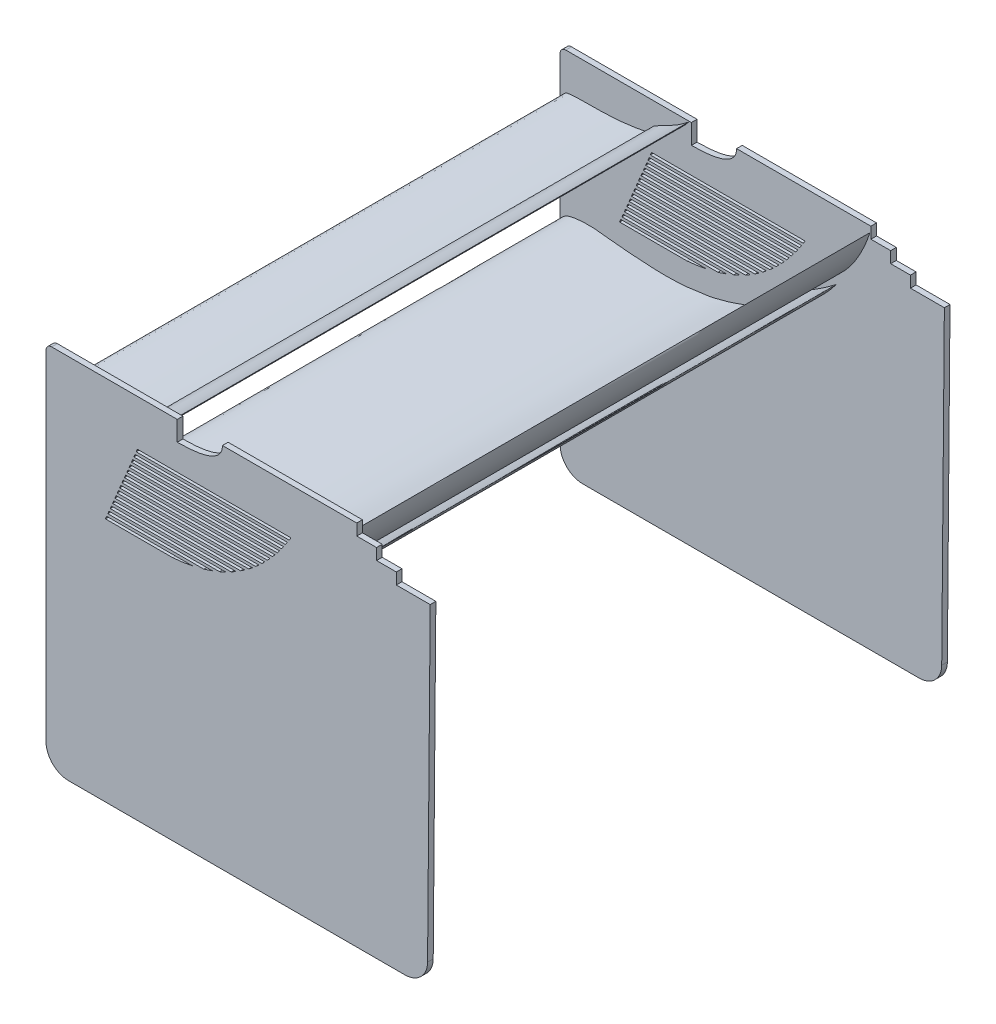
from build123d import *

# Parameters (mm, degrees)
BOSS_EXTRUDE1_DEPTH   = 900
BOSS_EXTRUDE1_2_DEPTH = 900
BOSS_EXTRUDE1_3_DEPTH = 900
BOSS_EXTRUDE2_DEPTH   = 10
BOSS_EXTRUDE3_DEPTH   = 900
CUT_EXTRUDE1_DEPTH    = 900
CUT_EXTRUDE2_DEPTH    = 900


with BuildPart() as part:
    # Sketch2 → Boss-Extrude1 (new body)
    with BuildSketch(Plane.XY):
        with BuildLine():
            add(Edge.make_bspline(
                [(0, 0), (-0.65975565, -5.699703464), (8.017548516, -15.480562025), (19.551157506, -21.724015646), (30.016745353, -25.302215165), (39.859962541, -28.8642232), (50.040399275, -30.662933418), (60.070603806, -32.257702331), (70.013877162, -34.217674322), (80.100972933, -34.55999195), (90.093066457, -35.36519438), (100.111969814, -35.952943269), (110.128217778, -35.507216678), (120.153157744, -35.210003546), (130.150331683, -34.229800116), (140.189993261, -33.410162922), (150.178235204, -31.913406007), (160.170449627, -30.371338734), (170.240789754, -29.163640841), (180.208316099, -27.151030087), (190.263801281, -25.306120223), (200.239152099, -22.872450662), (210.244577583, -20.429111012), (220.232934245, -17.895088966), (230.381125348, -15.705438437), (240.351948949, -12.391144832), (253.551193017, -7.369638816), (266.947574476, -2.806549313), (280.436865809, 1.636643436), (290.361357742, 5.819516769), (300.440735094, 10.032227759), (310.304777653, 14.884053202), (323.821431636, 20.884190166), (337.30228202, 27.249833417), (350.274680503, 34.850235797), (364.037447664, 41.200679435), (378.073354269, 50.431878374), (389.268655411, 56.991671546), (404.933124868, 70.670428585), (388.893146181, 60.897261379), (380.961681237, 56.833339948), (370.316551331, 52.173205743), (360.413556578, 47.749137904), (350.469658047, 43.075442492), (340.496714174, 38.833200032), (330.405194537, 35.260956145), (320.349773519, 31.849438488), (310.358327921, 28.32591748), (300.486931551, 24.662169398), (290.321799777, 22.300639283), (280.290360105, 19.76188557), (270.426731207, 16.765017679), (260.335958512, 15.061341224), (250.276874186, 13.958758108), (240.266180313, 12.578254982), (230.278688892, 11.06786106), (220.28670052, 9.696364143), (210.243264635, 9.240413966), (200.228739037, 9.034505305), (190.217040672, 8.279165066), (180.212460889, 9.162360851), (170.184221628, 8.728504773), (160.186505008, 9.582197967), (150.167787888, 9.989196896), (140.163470123, 10.700746944), (130.145958281, 11.214450998), (120.121382338, 11.840881885), (110.132801048, 12.969737489), (100.114836916, 13.850136605), (90.093770057, 14.715857774), (80.079633724, 15.842660607), (56.917746978, 18.847498868), (32.382831952, 18.963380484), (8.41761673, 12.262874152), (0.546057517, 4.717452477), (0, 0)],
                knots=[0, 0, 0, 0, 0.022023736, 0.035622153, 0.048196888, 0.060584536, 0.072602109, 0.084545422, 0.096478612, 0.108283816, 0.120089627, 0.131879307, 0.143660654, 0.15544949, 0.167268546, 0.17910001, 0.190991158, 0.20289685, 0.214787999, 0.226765538, 0.23876847, 0.250863752, 0.262991876, 0.27512, 0.287234564, 0.299600692, 0.31214973, 0.337081787, 0.34954249, 0.362249466, 0.375072168, 0.388091419, 0.401030286, 0.427260863, 0.440708926, 0.453891579, 0.481343844, 0.495528159, 0.510184265, 0.522427916, 0.535732546, 0.548643086, 0.561553626, 0.574510663, 0.587286643, 0.599816472, 0.612271303, 0.624763182, 0.637218013, 0.649381244, 0.661544475, 0.673750263, 0.685718325, 0.697586388, 0.709471547, 0.721375261, 0.733243324, 0.745039761, 0.756824219, 0.768610895, 0.780397571, 0.792175284, 0.803971722, 0.815766061, 0.82756692, 0.839363385, 0.851169099, 0.863005976, 0.874833225, 0.886659586, 0.898509641, 0.910371212, 0.969295412, 0.981771696, 1, 1, 1, 1], degree=3))
        make_face()
    extrude(amount=BOSS_EXTRUDE1_DEPTH)



with BuildPart() as body_2:
    # Sketch2 → Boss-Extrude1 2 (new body)
    with BuildSketch(Plane.XY):
        with BuildLine():
            add(Edge.make_bspline(
                [(488.73992863, 146.276625829), (488.734390863, 146.282664356), (488.424255517, 146.015046997), (488.06224571, 145.78510435), (487.262468982, 145.126312202), (486.219708703, 144.371292999), (484.873478649, 143.336701677), (483.250678892, 142.116067573), (481.344943871, 140.702556836), (479.183854282, 139.108333078), (476.761259361, 137.364331889), (474.123745832, 135.449437464), (471.236790602, 133.439330858), (468.165688429, 131.291310186), (464.896239769, 129.067635846), (461.457519682, 126.769533617), (457.874048726, 124.410588123), (454.151349507, 122.026984888), (450.329646269, 119.608278587), (446.41836705, 117.19210493), (442.442349173, 114.792641259), (438.43193703, 112.415341988), (434.42114363, 110.058907294), (430.419325782, 107.74839744), (426.469079038, 105.475179612), (422.572434597, 103.270040027), (418.782946314, 101.105445668), (415.103822048, 99.01892845), (411.581105321, 96.980001912), (408.223119368, 95.024650916), (405.070149132, 93.117181313), (402.117764879, 91.312769814), (399.415735867, 89.554324386), (396.965291652, 87.893504979), (394.792388291, 86.318571947), (392.915837215, 84.829964237), (391.349809227, 83.430905822), (390.083467317, 82.150893966), (389.152598068, 80.964624913), (388.566460536, 79.872034746), (388.31048608, 78.86894122), (388.452520239, 77.947544055), (389.013376817, 77.204475769), (389.915554573, 76.684991476), (391.128157446, 76.384212118), (392.650081725, 76.254634507), (394.48507873, 76.313765499), (396.623198675, 76.579439281), (399.045948072, 77.035742523), (401.735792151, 77.720460618), (404.675674285, 78.596752435), (407.839178956, 79.704940552), (411.200777121, 81.026852514), (414.720896472, 82.590974299), (418.395557374, 84.341793332), (422.179917585, 86.309143039), (426.045683707, 88.480043342), (429.970357242, 90.828820323), (433.914957703, 93.364526939), (437.871228384, 96.040204149), (441.793376071, 98.866131635), (445.668479549, 101.797178284), (449.465692449, 104.827226536), (453.167907327, 107.924049831), (456.76145535, 111.053999458), (460.202936902, 114.219487851), (463.519091154, 117.342970547), (466.650128692, 120.455005022), (469.613566921, 123.489837804), (472.370170636, 126.450937081), (474.953957291, 129.265647603), (477.297780382, 131.960513478), (479.456204478, 134.463515761), (481.381106749, 136.784579704), (483.077897662, 138.897364919), (484.557730654, 140.769579134), (485.809879979, 142.38248786), (486.847928071, 143.738913606), (487.625844434, 144.768628828), (488.251100258, 145.595659419), (488.480713959, 145.957078055), (488.74539046, 146.270670107), (488.73992863, 146.276625829)],
                knots=[0, 0, 0, 0, 0.000781199, 0.003073574, 0.006930933, 0.012248071, 0.019030102, 0.027225991, 0.036784991, 0.047610037, 0.059602429, 0.072763906, 0.086896902, 0.102003859, 0.117938515, 0.134556032, 0.151857595, 0.169650659, 0.187837924, 0.206373783, 0.225065344, 0.243814112, 0.262569213, 0.281136751, 0.299513586, 0.317505655, 0.335105223, 0.352118009, 0.368487898, 0.384166869, 0.39895523, 0.412906354, 0.425871787, 0.437810597, 0.448585292, 0.458212857, 0.466668993, 0.473884465, 0.479894259, 0.484778924, 0.488742849, 0.492166792, 0.495627983, 0.499576303, 0.504486665, 0.51057614, 0.517942731, 0.526573967, 0.536524046, 0.547640111, 0.560015283, 0.573490911, 0.58803144, 0.603543533, 0.619911609, 0.637089411, 0.654944026, 0.673346428, 0.692212491, 0.711460838, 0.730910148, 0.750475101, 0.77002178, 0.789460649, 0.808651173, 0.827457923, 0.845819698, 0.863558965, 0.880665567, 0.896944906, 0.912322084, 0.926717772, 0.939992516, 0.952161421, 0.963060032, 0.972661788, 0.980906352, 0.987732879, 0.993080076, 0.996902186, 0.999229514, 1, 1, 1, 1], degree=3))
        make_face()
    extrude(amount=BOSS_EXTRUDE1_2_DEPTH)


with BuildPart() as body_3:
    # Sketch2 → Boss-Extrude1 3 (new body)
    with BuildSketch(Plane.XY):
        with BuildLine():
            add(Edge.make_bspline(
                [(548.142677429, 255.362022493), (548.135374227, 255.365952606), (547.927936153, 255.006923964), (547.658371583, 254.666651265), (547.113002911, 253.770748213), (546.367364831, 252.702005657), (545.424638558, 251.265023805), (544.27941979, 249.558165284), (542.927897021, 247.572779047), (541.392389605, 245.329670238), (539.656724271, 242.856366084), (537.77246287, 240.148181213), (535.681420522, 237.265978202), (533.460225952, 234.1906606), (531.074588655, 230.97702341), (528.551895931, 227.635912658), (525.911068883, 224.188473742), (523.145346923, 220.671136821), (520.29665909, 217.087300279), (517.361495783, 213.476080086), (514.358883712, 209.859293663), (511.316016626, 206.252251869), (508.265842752, 202.665029322), (505.208968651, 199.124696426), (502.1889872, 195.637173296), (499.197596623, 192.232566763), (496.295154414, 188.902374923), (493.472239146, 185.683544867), (490.783011296, 182.562252326), (488.223454385, 179.575667492), (485.843956575, 176.703071592), (483.621924068, 173.995738505), (481.623931594, 171.41564926), (479.833965661, 169.012598811), (478.280745879, 166.784000715), (476.982109533, 164.736533764), (475.9505309, 162.877995089), (475.165835333, 161.232977644), (474.670653437, 159.789198906), (474.473857946, 158.549678558), (474.562913108, 157.505571006), (475.005273255, 156.671993733), (475.788683212, 156.148250847), (476.823995566, 155.951818146), (478.083297743, 156.067751239), (479.581340455, 156.450270824), (481.315884792, 157.117361276), (483.27148496, 158.082761094), (485.435756441, 159.325104089), (487.779363945, 160.874677932), (490.298259918, 162.690587977), (492.953775055, 164.80259248), (495.727550679, 167.184824621), (498.572278285, 169.851349424), (501.502624239, 172.747773867), (504.46579375, 175.887697633), (507.439057803, 179.249297912), (510.409450838, 182.800544998), (513.336696107, 186.537123271), (516.228525151, 190.411393589), (519.037740226, 194.417946242), (521.767005491, 198.509337516), (524.388867963, 202.669455575), (526.897696092, 206.861800297), (529.291618766, 211.049656155), (531.528344155, 215.220888935), (533.659235885, 219.310264722), (535.616969063, 223.327101968), (537.440168258, 227.214370322), (539.090171449, 230.962330487), (540.623673351, 234.512844247), (541.967651222, 237.868945421), (543.198230675, 240.979940777), (544.266104832, 243.839306635), (545.18521028, 246.423662369), (545.97695415, 248.705848341), (546.637316417, 250.664385968), (547.178342468, 252.306492823), (547.579395063, 253.549717004), (547.901947032, 254.548383811), (548.001197383, 254.970292394), (548.149880485, 255.358146272), (548.142677429, 255.362022493)],
                knots=[0, 0, 0, 0, 0.000781199, 0.003073574, 0.006930933, 0.012248071, 0.019030102, 0.027225991, 0.036784991, 0.047610037, 0.059602429, 0.072763906, 0.086896902, 0.102003859, 0.117938515, 0.134556032, 0.151857595, 0.169650659, 0.187837924, 0.206373783, 0.225065344, 0.243814112, 0.262569213, 0.281136751, 0.299513586, 0.317505655, 0.335105223, 0.352118009, 0.368487898, 0.384166869, 0.39895523, 0.412906354, 0.425871787, 0.437810597, 0.448585292, 0.458212857, 0.466668993, 0.473884465, 0.479894259, 0.484778924, 0.488742849, 0.492166792, 0.495627983, 0.499576303, 0.504486665, 0.51057614, 0.517942731, 0.526573967, 0.536524046, 0.547640111, 0.560015283, 0.573490911, 0.58803144, 0.603543533, 0.619911609, 0.637089411, 0.654944026, 0.673346428, 0.692212491, 0.711460838, 0.730910148, 0.750475101, 0.77002178, 0.789460649, 0.808651173, 0.827457923, 0.845819698, 0.863558965, 0.880665567, 0.896944906, 0.912322084, 0.926717772, 0.939992516, 0.952161421, 0.963060032, 0.972661788, 0.980906352, 0.987732879, 0.993080076, 0.996902186, 0.999229514, 1, 1, 1, 1], degree=3))
        make_face()
    extrude(amount=BOSS_EXTRUDE1_3_DEPTH)


with BuildPart() as part_1:
    add(part.part)

    add(body_2.part)  # Boss-Extrude2 merges body 2

    add(body_3.part)  # Boss-Extrude2 merges body 3
    # Sketch5 → Boss-Extrude2 (add)
    with BuildSketch(Plane.XY):
        with BuildLine():
            Line((10, 266.2835253), (550.000000941, 266.2835253))
            Line((550.000000941, 266.2835253), (550.000000941, 246.2835253))
            Line((550.000000941, 246.2835253), (585.000000941, 246.2835253))
            Line((585.000000941, 246.2835253), (585.000000941, 226.2835253))
            Line((585.000000941, 226.2835253), (620.000000941, 226.2835253))
            Line((620.000000941, 226.2835253), (620.000000941, 206.2835253))
            Line((620.000000941, 206.2835253), (680.000000941, 206.2835253))
            Line((680.000000941, 206.2835253), (675.336111358, -344.055445579))
            ThreePointArc((675.336111358, -344.055445579), (663.501719613, -372.120337423), (635.337547649, -383.7164747))
            Line((635.337547649, -383.7164747), (40, -383.7164747))
            ThreePointArc((40, -383.7164747), (11.715728753, -372.000745948), (0, -343.7164747))
            Line((0, -343.7164747), (0, 0))
            Line((0, 0), (0, 256.2835253))
            ThreePointArc((0, 256.2835253), (2.928932188, 263.354593111), (10, 266.2835253))
        make_face()
    boss_extrude2 = extrude(amount=-BOSS_EXTRUDE2_DEPTH)

    # Sketch6 → Boss-Extrude3 (add)
    with BuildSketch(Plane.XY):
        with BuildLine():
            Line((164.613779142, 214.976136412), (164.723820378, 214.664469851))
            add(Edge.make_bspline(
                [(164.723820378, 214.664469851), (164.648520792, 214.62785328), (164.34784185, 214.481639572), (163.6724355, 214.155247545), (162.549996952, 213.617503095), (160.985188719, 212.878254816), (158.984976969, 211.950245078), (156.558091459, 210.85008651), (153.715646415, 209.596574891), (150.470623362, 208.21147628), (146.838789716, 206.717746076), (142.837921693, 205.140231242), (138.488175426, 203.504962048), (133.812181859, 201.837638924), (128.834692226, 200.164989269), (123.582914289, 198.512714614), (118.086213642, 196.905948015), (112.376209789, 195.368272822), (106.486191905, 193.922834665), (100.451747873, 192.589384758), (94.309682922, 191.38731623), (88.098789404, 190.332048871), (81.858862431, 189.437445075), (75.630944666, 188.713169975), (69.456595048, 188.167141909), (63.377832973, 187.802732102), (57.436667454, 187.619920942), (51.674457693, 187.615799885), (46.131746943, 187.783455241), (40.847534236, 188.112237796), (35.858963346, 188.588868306), (31.20097477, 189.198026011), (26.905404603, 189.920290668), (23.001348407, 190.736844339), (19.514136341, 191.626300897), (16.465607968, 192.567963312), (13.873059459, 193.541178882), (11.74976335, 194.527328758), (10.100256038, 195.510564925), (8.925718365, 196.483778626), (8.206176783, 197.466132507), (8.02697547, 198.508882414), (8.470227148, 199.467441428), (9.409476098, 200.23160778), (10.773566742, 200.880043737), (12.581737712, 201.435839127), (14.827891197, 201.90662304), (17.501946446, 202.294971106), (20.58639208, 202.606885827), (24.061416159, 202.847331482), (27.90441349, 203.025263473), (32.091168331, 203.149306121), (36.595944484, 203.230963582), (41.391766004, 203.282006476), (46.450521964, 203.315413628), (51.743070657, 203.344475349), (57.239340133, 203.383502231), (62.908274903, 203.445583094), (68.717937055, 203.543500979), (74.635487392, 203.689136944), (80.627254443, 203.892101324), (86.658821204, 204.160206649), (92.695207803, 204.498909479), (98.701000079, 204.910411263), (104.640477999, 205.395096222), (110.477863333, 205.94945889), (116.177758049, 206.567602145), (121.705063984, 207.24121294), (127.025524467, 207.95920193), (132.10555678, 208.709379121), (136.913134386, 209.476904936), (141.417305129, 210.247217657), (145.589030953, 211.004246644), (149.400935644, 211.732409722), (152.827876226, 212.416494827), (155.846829262, 213.041879937), (158.437432591, 213.595225115), (160.581893041, 214.064998422), (162.265605107, 214.441007828), (163.476700085, 214.71550428), (164.206793843, 214.882591132), (164.532232533, 214.957392982), (164.613779142, 214.976136412)],
                knots=[0, 0, 0, 0, 0.000779512, 0.003112672, 0.006983595, 0.012366453, 0.01922443, 0.027511488, 0.037172952, 0.048145315, 0.060357993, 0.073731396, 0.088181725, 0.103618331, 0.119946063, 0.137064586, 0.154870456, 0.17325674, 0.192112831, 0.211327336, 0.230785914, 0.250372996, 0.269971687, 0.289465461, 0.308737124, 0.32767029, 0.346151173, 0.364066139, 0.381306847, 0.39776766, 0.413347451, 0.427951846, 0.441492525, 0.453889871, 0.465073667, 0.474985038, 0.483580064, 0.490834634, 0.496756017, 0.501407245, 0.504968517, 0.50787306, 0.510776977, 0.514326794, 0.518938798, 0.524777979, 0.531895445, 0.540287366, 0.549922226, 0.560751286, 0.572712462, 0.585735823, 0.599744882, 0.61465722, 0.63038614, 0.646841751, 0.663930407, 0.681556403, 0.699621216, 0.718024312, 0.736663476, 0.755434295, 0.774231121, 0.792947914, 0.811476445, 0.829708517, 0.847535554, 0.86485073, 0.881545736, 0.89751548, 0.912656405, 0.926869016, 0.94005631, 0.952127904, 0.962998201, 0.972589475, 0.980830171, 0.987660039, 0.993027268, 0.996891237, 0.999221024, 1, 1, 1, 1], degree=3))
        make_face()
        with BuildLine():
            Line((227.014165374, 264.226922408), (227.124498683, 264.117683735))
            add(Edge.make_bspline(
                [(227.124498683, 264.117683735), (227.100159849, 264.086786218), (227.002972401, 263.963409277), (226.784244674, 263.687135237), (226.419789721, 263.229980722), (225.90956242, 262.59706416), (225.25389914, 261.795199069), (224.453089487, 260.833196326), (223.507984217, 259.721278001), (222.419615428, 258.471304258), (221.18994955, 257.09620847), (219.821415035, 255.610135011), (218.317204263, 254.028215794), (216.681623457, 252.365949967), (214.919665011, 250.639704962), (213.037569937, 248.865917434), (211.042607934, 247.061225478), (208.943318901, 245.242073454), (206.749038269, 243.425062503), (204.470768289, 241.625829285), (202.120099201, 239.8601083), (199.710274859, 238.142361018), (197.255281925, 236.486595763), (194.770493839, 234.905301737), (192.271859948, 233.410335323), (189.776455231, 232.011724723), (187.302044509, 230.718062416), (184.866709335, 229.536586443), (182.489006296, 228.472674472), (180.187603898, 227.52980869), (177.980924736, 226.709979502), (175.886877861, 226.013863102), (173.922899143, 225.439766898), (172.105142481, 224.985691856), (170.448695615, 224.647782235), (168.967029431, 224.421758982), (167.671684859, 224.302431588), (166.572085289, 224.284645643), (165.673393307, 224.362629601), (164.977563579, 224.533619745), (164.472228287, 224.801628451), (164.182975782, 225.205799004), (164.174124327, 225.701813604), (164.414772581, 226.217190457), (164.858731971, 226.770618702), (165.509408986, 227.375799229), (166.362663608, 228.034709064), (167.413706516, 228.746373252), (168.653905221, 229.509744345), (170.073867156, 230.322864947), (171.662201674, 231.184893168), (173.406905, 232.094517404), (175.294740921, 233.051332311), (177.311894526, 234.054791381), (179.443823684, 235.104626545), (181.675486694, 236.200490389), (183.991239673, 237.342276403), (186.375273051, 238.529160164), (188.811466791, 239.760007307), (191.28350447, 241.033117593), (193.775182692, 242.345660362), (196.270350938, 243.693892226), (198.753103068, 245.072958488), (201.208015771, 246.476539327), (203.619908469, 247.897483995), (205.974372342, 249.326985329), (208.257648968, 250.755302848), (210.456601334, 252.171736048), (212.559016607, 253.564582929), (214.553192236, 254.921814136), (216.428626064, 256.230598714), (218.17521328, 257.47844315), (219.783967257, 258.652607865), (221.246503967, 259.740900035), (222.555307784, 260.731740538), (223.703638392, 261.614233662), (224.685618133, 262.378570601), (225.496085319, 263.016232908), (226.130951632, 263.519921264), (226.586785668, 263.883929527), (226.861249996, 264.104048143), (226.983526109, 264.202302404), (227.014165374, 264.226922408)],
                knots=[0, 0, 0, 0, 0.000779512, 0.003112672, 0.006983595, 0.012366453, 0.01922443, 0.027511488, 0.037172952, 0.048145315, 0.060357993, 0.073731396, 0.088181725, 0.103618331, 0.119946063, 0.137064586, 0.154870456, 0.17325674, 0.192112831, 0.211327336, 0.230785914, 0.250372996, 0.269971687, 0.289465461, 0.308737124, 0.32767029, 0.346151173, 0.364066139, 0.381306847, 0.39776766, 0.413347451, 0.427951846, 0.441492525, 0.453889871, 0.465073667, 0.474985038, 0.483580064, 0.490834634, 0.496756017, 0.501407245, 0.504968517, 0.50787306, 0.510776977, 0.514326794, 0.518938798, 0.524777979, 0.531895445, 0.540287366, 0.549922226, 0.560751286, 0.572712462, 0.585735823, 0.599744882, 0.61465722, 0.63038614, 0.646841751, 0.663930407, 0.681556403, 0.699621216, 0.718024312, 0.736663476, 0.755434295, 0.774231121, 0.792947914, 0.811476445, 0.829708517, 0.847535554, 0.86485073, 0.881545736, 0.89751548, 0.912656405, 0.926869016, 0.94005631, 0.952127904, 0.962998201, 0.972589475, 0.980830171, 0.987660039, 0.993027268, 0.996891237, 0.999221024, 1, 1, 1, 1], degree=3))
        make_face()
    extrude(amount=BOSS_EXTRUDE3_DEPTH)

    # Sketch7 → Cut-Extrude1 (cut)
    with BuildSketch(Plane.XY):
        with BuildLine():
            Line((232.261297878, 266.2835253), (232.261297878, 231.2835253))
            add(Edge.make_bspline(
                [(312.261297878, 266.2835253), (312.261297878, 231.2835253), (232.261297878, 231.2835253)],
                knots=[0, 0, 0, 1, 1, 1], degree=2))
            Line((312.261297878, 266.2835253), (232.261297878, 266.2835253))
        make_face()
    cut_extrude1 = extrude(amount=-CUT_EXTRUDE1_DEPTH, mode=Mode.SUBTRACT)

    # Sketch8 → Cut-Extrude2 (cut)
    with BuildSketch(Plane.XY):
        with BuildLine():
            Line((161.803662931, 185.278358624), (433.527522538, 185.278358624))
            add(Edge.make_bspline(
                [(433.527522538, 185.278358624), (431.986033483, 182.754958382), (430.420792306, 180.278358625)],
                knots=[0, 0, 0, 0.017044084, 0.017044084, 0.017044084], degree=2))
            Line((430.420792306, 180.278358625), (159.708601591, 180.278358625))
            Line((159.708601591, 180.278358625), (161.803662931, 185.278358624))
        make_face()
        with BuildLine():
            Line((155.51847891, 170.278358624), (423.874587116, 170.278358624))
            add(Edge.make_bspline(
                [(427.205326309, 175.278358623), (426.103638199, 173.59482896), (424.993391797, 171.928162297), (423.874587116, 170.278358624)],
                knots=[0.034416516, 0.034416516, 0.034416516, 0.034416516, 0.052137037, 0.052137037, 0.052137037, 0.052137037], degree=3))
            Line((427.205326309, 175.278358623), (157.61354025, 175.278358623))
            Line((157.61354025, 175.278358623), (155.51847891, 170.278358624))
        make_face()
        with BuildLine():
            Line((151.328356229, 160.278358623), (416.837622605, 160.278358623))
            add(Edge.make_bspline(
                [(420.421354783, 165.278358623), (419.236089505, 163.593343639), (418.041512112, 161.926676973), (416.837622605, 160.278358623)],
                knots=[0.070227449, 0.070227449, 0.070227449, 0.070227449, 0.088711929, 0.088711929, 0.088711929, 0.088711929], degree=3))
            Line((420.421354783, 165.278358623), (153.42341757, 165.278358623))
            Line((153.42341757, 165.278358623), (151.328356229, 160.278358623))
        make_face()
        with BuildLine():
            Line((147.138233549, 150.278358623), (409.241918291, 150.278358623))
            add(Edge.make_bspline(
                [(413.114471658, 155.278358622), (411.833832124, 153.591571342), (410.542981002, 151.924904676), (409.241918291, 150.278358623)],
                knots=[0.107617411, 0.107617411, 0.107617411, 0.107617411, 0.12697404, 0.12697404, 0.12697404, 0.12697404], degree=3))
            Line((413.114471658, 155.278358622), (149.233294889, 155.278358622))
            Line((149.233294889, 155.278358622), (147.138233549, 150.278358623))
        make_face()
        with BuildLine():
            Line((142.948110868, 140.278358622), (401.00217999, 140.278358622))
            add(Edge.make_bspline(
                [(405.208727185, 145.278358621), (403.817848225, 143.589419991), (402.415665827, 141.922753326), (401.00217999, 140.278358622)],
                knots=[0.146815745, 0.146815745, 0.146815745, 0.146815745, 0.167180931, 0.167180931, 0.167180931, 0.167180931], degree=3))
            Line((405.208727185, 145.278358621), (145.043172208, 145.278358621))
            Line((145.043172208, 145.278358621), (142.948110868, 140.278358622))
        make_face()
        with BuildLine():
            Line((138.757988187, 130.278358621), (392.008915127, 130.278358621))
            add(Edge.make_bspline(
                [(396.607785875, 135.278358621), (395.087485747, 133.586753391), (393.554528832, 131.920086723), (392.008915127, 130.278358621)],
                knots=[0.188113355, 0.188113355, 0.188113355, 0.188113355, 0.209663235, 0.209663235, 0.209663235, 0.209663235], degree=3))
            Line((396.607785875, 135.278358621), (140.853049527, 135.278358621))
            Line((140.853049527, 135.278358621), (138.757988187, 130.278358621))
        make_face()
        with BuildLine():
            Line((134.567865506, 120.278358621), (382.117568981, 120.278358621))
            add(Edge.make_bspline(
                [(387.186329186, 125.27835862), (385.511120845, 123.583361188), (383.821534109, 121.916694525), (382.117568981, 120.278358621)],
                knots=[0.231888664, 0.231888664, 0.231888664, 0.231888664, 0.254857463, 0.254857463, 0.254857463, 0.254857463], degree=3))
            Line((387.186329186, 125.27835862), (136.662926846, 125.27835862))
            Line((136.662926846, 125.27835862), (134.567865506, 120.278358621))
        make_face()
        with BuildLine():
            Line((130.377742825, 110.27835862), (371.130448262, 110.27835862))
            add(Edge.make_bspline(
                [(376.776145493, 115.278358619), (374.910888715, 113.578900458), (373.028989635, 111.912233792), (371.130448262, 110.27835862)],
                knots=[0.278649618, 0.278649618, 0.278649618, 0.278649618, 0.303360585, 0.303360585, 0.303360585, 0.303360585], degree=3))
            Line((376.776145493, 115.278358619), (132.472804165, 115.278358619))
            Line((132.472804165, 115.278358619), (130.377742825, 110.27835862))
        make_face()
        with BuildLine():
            Line((126.187620144, 100.278358619), (358.764540814, 100.278358619))
            add(Edge.make_bspline(
                [(365.142241667, 105.278358619), (363.036094183, 103.572771614), (360.9101939, 101.906104944), (358.764540814, 100.278358619)],
                knots=[0.329105822, 0.329105822, 0.329105822, 0.329105822, 0.35602721, 0.35602721, 0.35602721, 0.35602721], degree=3))
            Line((365.142241667, 105.278358619), (128.282681484, 105.278358619))
            Line((128.282681484, 105.278358619), (126.187620144, 100.278358619))
        make_face()
        with BuildLine():
            Line((121.997497463, 90.278358619), (344.58887312, 90.278358619))
            add(Edge.make_bspline(
                [(351.938522321, 95.278358618), (349.512933739, 93.563822812), (347.063050674, 91.897156142), (344.58887312, 90.278358619)],
                knots=[0.384302376, 0.384302376, 0.384302376, 0.384302376, 0.414158742, 0.414158742, 0.414158742, 0.414158742], degree=3))
            Line((351.938522321, 95.278358618), (124.092558803, 95.278358618))
            Line((124.092558803, 95.278358618), (121.997497463, 90.278358619))
        make_face()
        with BuildLine():
            Line((117.807374782, 80.278358618), (327.886387735, 80.278358618))
            add(Edge.make_bspline(
                [(336.616487009, 85.278358617), (333.738005948, 83.549522756), (330.827972857, 81.882856089), (327.886387735, 80.278358618)],
                knots=[0.445895578, 0.445895578, 0.445895578, 0.445895578, 0.47992047, 0.47992047, 0.47992047, 0.47992047], degree=3))
            Line((336.616487009, 85.278358617), (119.902436122, 85.278358617))
            Line((119.902436122, 85.278358617), (117.807374782, 80.278358618))
        make_face()
        with BuildLine():
            Line((113.617252101, 70.278358617), (307.286080617, 70.278358617))
            add(Edge.make_bspline(
                [(318.206400634, 75.278358617), (314.611304353, 73.523004798), (310.97119768, 71.856338132), (307.286080617, 70.278358617)],
                knots=[0.516813724, 0.516813724, 0.516813724, 0.516813724, 0.557452394, 0.557452394, 0.557452394, 0.557452394], degree=3))
            Line((318.206400634, 75.278358617), (115.712313441, 75.278358617))
            Line((115.712313441, 75.278358617), (113.617252101, 70.278358617))
        make_face()
        with BuildLine():
            Line((109.42712942, 60.278358617), (279.393756019, 60.278358617))
            add(Edge.make_bspline(
                [(294.647543822, 65.278358616), (289.641612, 63.456694494), (284.557016067, 61.790027823), (279.393756019, 60.278358617)],
                knots=[0.603279538, 0.603279538, 0.603279538, 0.603279538, 0.657003919, 0.657003919, 0.657003919, 0.657003919], degree=3))
            Line((294.647543822, 65.278358616), (111.52219076, 65.278358616))
            Line((111.52219076, 65.278358616), (109.42712942, 60.278358617))
        make_face()
        with BuildLine():
            Line((105.237006739, 50.278358616), (224.538691684, 50.278358616))
            add(Edge.make_bspline(
                [(259.386529007, 55.278358615), (248.117929064, 52.927291927), (236.50198329, 51.260625257), (224.538691684, 50.278358616)],
                knots=[0.725082192, 0.725082192, 0.725082192, 0.725082192, 0.837974445, 0.837974445, 0.837974445, 0.837974445], degree=3))
            Line((259.386529007, 55.278358615), (107.332068079, 55.278358615))
            Line((107.332068079, 55.278358615), (105.237006739, 50.278358616))
        make_face()
    cut_extrude2 = extrude(amount=-CUT_EXTRUDE2_DEPTH, mode=Mode.SUBTRACT)

    # Mirror1: Boss-Extrude2, Cut-Extrude1, Cut-Extrude2 across plane
    add(boss_extrude2.mirror(Plane.XY.offset(450)))
    add(cut_extrude1.mirror(Plane.XY.offset(450)), mode=Mode.SUBTRACT)
    add(cut_extrude2.mirror(Plane.XY.offset(450)), mode=Mode.SUBTRACT)


solid = part_1.part
